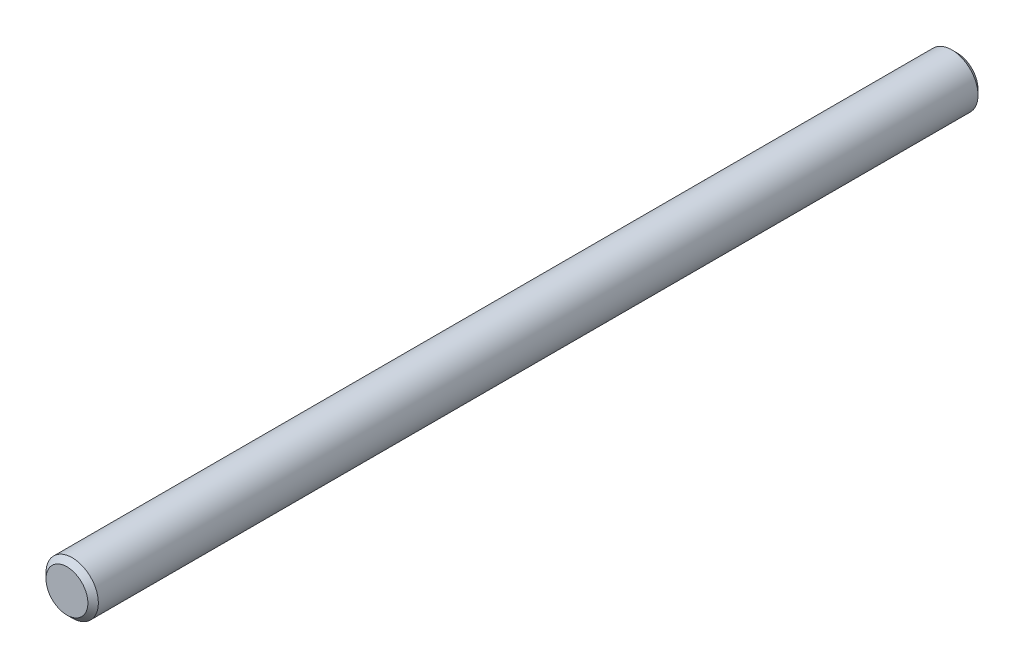
from build123d import *

# Parameters (mm, degrees)
SKETCH1_W     = 17
SKETCH1_H     = 0.5
CHAMFER1_SIZE = 0.1


with BuildPart() as part:
    # Sketch1 → Revolve1 (revolve)
    with BuildSketch(Plane(origin=(0, 0, 0), x_dir=(0, 0, -1), z_dir=(1, 0, 0)), mode=Mode.PRIVATE) as revolve1_sk:
        with Locations((8.5, 0.25)):
            Rectangle(SKETCH1_W, SKETCH1_H)
    revolve(revolve1_sk.sketch.rotate(Axis((0, 0, 5.654205607), (0, 0, -1)), 90), axis=Axis((0, 0, 5.654205607), (0, 0, -1)))

    # Chamfer1
    chamfer1_edges = [part.edges().sort_by_distance(p)[0] for p in [
        (-0.5, 0, -17),
        (-0.5, 0, 0),
    ]]
    chamfer(chamfer1_edges, length=CHAMFER1_SIZE)


solid = part.part
